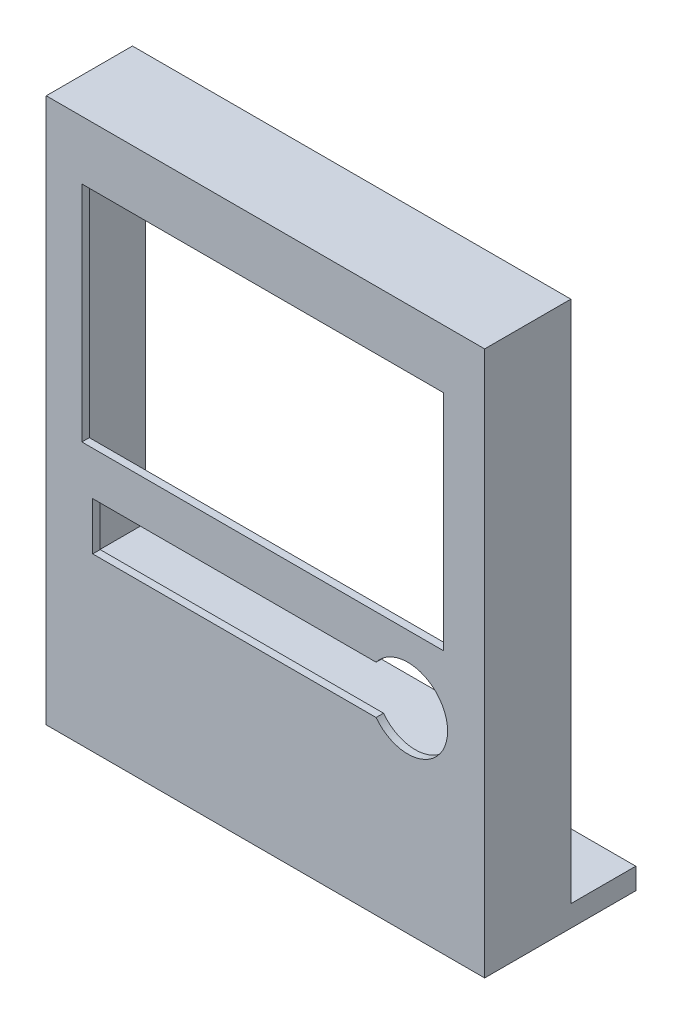
from build123d import *

# Parameters (mm, degrees)
SKETCH1_W           = 104.648
SKETCH1_H           = 130.048
BOSS_EXTRUDE1_DEPTH = 36.068
SKETCH2_W           = 15.494
SKETCH2_H           = 124.968
CUT_EXTRUDE1_DEPTH  = 129.375329032
SKETCH3_W           = 98.298
SKETCH3_H           = 93.853
CUT_EXTRUDE2_DEPTH  = 18.796
SKETCH4_W           = 86.36
SKETCH4_H           = 53.34
CUT_EXTRUDE3_DEPTH  = 18.796
CUT_EXTRUDE4_DEPTH  = 18.796


with BuildPart() as part:
    # Sketch1 → Boss-Extrude1 (new body)
    with BuildSketch(Plane.XY):
        Rectangle(SKETCH1_W, SKETCH1_H)
    extrude(amount=BOSS_EXTRUDE1_DEPTH)

    # Sketch2 → Cut-Extrude1 (cut, through all)
    with BuildSketch(Plane(origin=(52.324, 0, 0), x_dir=(0, 0, -1), z_dir=(1, 0, 0))):
        with Locations((-7.747, 2.54)):
            Rectangle(SKETCH2_W, SKETCH2_H)
    extrude(amount=-CUT_EXTRUDE1_DEPTH, mode=Mode.SUBTRACT)

    # Sketch3 → Cut-Extrude2 (cut)
    with BuildSketch(Plane(origin=(0, 0, 15.494), x_dir=(-1, 0, 0), z_dir=(0, 0, -1))):
        with Locations((0, 14.9225)):
            Rectangle(SKETCH3_W, SKETCH3_H)
    extrude(amount=-CUT_EXTRUDE2_DEPTH, mode=Mode.SUBTRACT)

    # Sketch4 → Cut-Extrude3 (cut)
    with BuildSketch(Plane.XY.offset(36.068)):
        with Locations((-0.637536215, 24.384)):
            Rectangle(SKETCH4_W, SKETCH4_H)
    extrude(amount=-CUT_EXTRUDE3_DEPTH, mode=Mode.SUBTRACT)

    # Sketch5 → Cut-Extrude4 (cut)
    with BuildSketch(Plane.XY.offset(36.068)):
        with BuildLine():
            ThreePointArc((43.47484815, -18.415), (36.997914828, -9.415751935), (26.407785194, -12.7))
            Line((26.407785194, -12.7), (40.558113562, -12.7))
            Line((40.558113562, -12.7), (40.558113562, -24.13))
            Line((40.558113562, -24.13), (26.407785194, -24.13))
            ThreePointArc((26.407785194, -24.13), (36.997914828, -27.414248065), (43.47484815, -18.415))
        make_face()
        with BuildLine():
            Line((40.558113562, -12.7), (26.407785194, -12.7))
            ThreePointArc((26.407785194, -12.7), (24.494085978, -18.415), (26.407785194, -24.13))
            Line((26.407785194, -24.13), (40.558113562, -24.13))
            Line((40.558113562, -24.13), (40.558113562, -12.7))
        make_face()
        with BuildLine():
            Line((26.407785194, -12.7), (-41.229886438, -12.7))
            Line((-41.229886438, -12.7), (-41.229886438, -24.13))
            Line((-41.229886438, -24.13), (26.407785194, -24.13))
            ThreePointArc((26.407785194, -24.13), (24.494085978, -18.415), (26.407785194, -12.7))
        make_face()
    extrude(amount=-CUT_EXTRUDE4_DEPTH, mode=Mode.SUBTRACT)


solid = part.part
